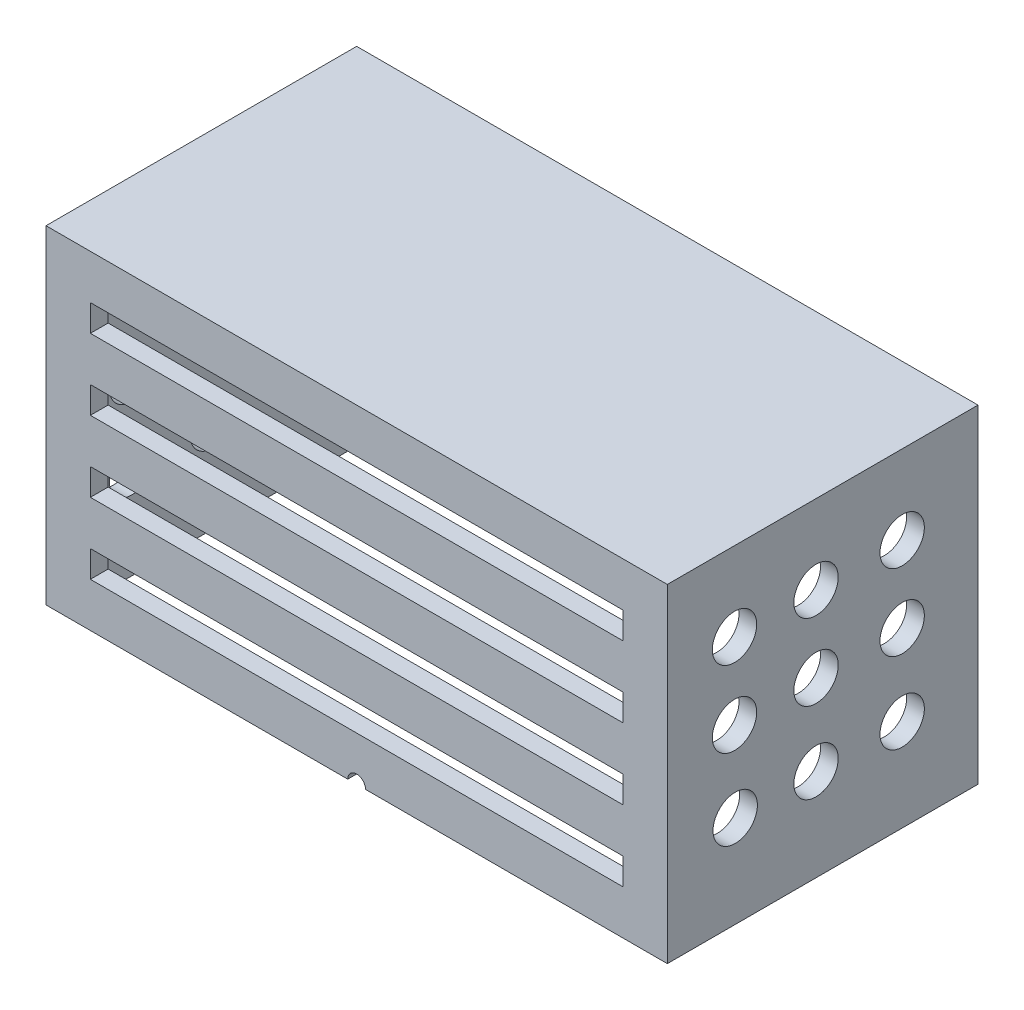
from build123d import *

# Parameters (mm, degrees)
SKETCH1_W           = 70
SKETCH1_H           = 35
BOSS_EXTRUDE1_DEPTH = 37
SHELL1_T            = -2
CUT_EXTRUDE1_DEPTH  = 2
SKETCH3_W           = 60
SKETCH3_H           = 30
CUT_EXTRUDE3_DEPTH  = 2
SKETCH4_W           = 60
SKETCH4_H           = 3
CUT_EXTRUDE4_DEPTH  = 2
SKETCH5_R           = 2.5
CUT_EXTRUDE5_DEPTH  = 2
CUT_EXTRUDE6_START  = -2
SKETCH6_R           = 2.5
CUT_EXTRUDE6_DEPTH  = 2


with BuildPart() as part:
    # Sketch1 → Boss-Extrude1 (new body)
    with BuildSketch(Plane(origin=(0, 0, 0), x_dir=(1, 0, 0), z_dir=(0, 1, 0))):
        with Locations((-44.968255968, 17.192111045)):
            Rectangle(SKETCH1_W, SKETCH1_H)
    extrude(amount=BOSS_EXTRUDE1_DEPTH)

    # Shell1
    shell1_openings = [part.faces().sort_by_distance(p)[0] for p in [
        (-44.968255968, 0, -17.192111045),
    ]]
    offset(amount=SHELL1_T, openings=shell1_openings, kind=Kind.INTERSECTION)

    # Sketch2 → Cut-Extrude1 (cut)
    with BuildSketch(Plane.XY.offset(0.307888955)):
        with BuildLine():
            Line((-45.968255968, 0), (-44.968255968, 0))
            Line((-44.968255968, 0), (-43.968255968, 0))
            ThreePointArc((-43.968255968, 0), (-44.968255968, 1), (-45.968255968, 0))
        make_face()
    extrude(amount=-CUT_EXTRUDE1_DEPTH, mode=Mode.SUBTRACT)

    # Sketch3 → Cut-Extrude3 (cut)
    with BuildSketch(Plane(origin=(0, 0, -34.692111045), x_dir=(-1, 0, 0), z_dir=(0, 0, -1))):
        with Locations((44.968255968, 15)):
            Rectangle(SKETCH3_W, SKETCH3_H)
    extrude(amount=-CUT_EXTRUDE3_DEPTH, mode=Mode.SUBTRACT)

    # Sketch4 → Cut-Extrude4 (cut)
    with BuildSketch(Plane.XY.offset(0.307888955)):
        with Locations((-44.968255968, 14.5)):
            Rectangle(SKETCH4_W, SKETCH4_H)
        with Locations((-44.968255968, 22.5)):
            Rectangle(SKETCH4_W, SKETCH4_H)
        with Locations((-44.968255968, 30.5)):
            Rectangle(SKETCH4_W, SKETCH4_H)
        with Locations((-44.968255968, 6.5)):
            Rectangle(SKETCH4_W, SKETCH4_H)
    extrude(amount=-CUT_EXTRUDE4_DEPTH, mode=Mode.SUBTRACT)

    # Sketch5 → Cut-Extrude5 (cut)
    with BuildSketch(Plane.ZY.offset(79.968255968)):
        with Locations((-26.149373003, 28.09173468)):
            Circle(SKETCH5_R)
        with Locations((-26.149373003, 19.50769197)):
            Circle(SKETCH5_R)
        with Locations((-26.149373003, 10.401142313)):
            Circle(SKETCH5_R)
        with Locations((-16.445672549, 10.401142313)):
            Circle(SKETCH5_R)
        with Locations((-16.445672549, 19.50769197)):
            Circle(SKETCH5_R)
        with Locations((-16.445672549, 28.09173468)):
            Circle(SKETCH5_R)
        with Locations((-7.339122891, 28.09173468)):
            Circle(SKETCH5_R)
        with Locations((-7.339122891, 19.50769197)):
            Circle(SKETCH5_R)
        with Locations((-7.339122891, 10.401142313)):
            Circle(SKETCH5_R)
    extrude(amount=-CUT_EXTRUDE5_DEPTH, mode=Mode.SUBTRACT)

    # Sketch6 → Cut-Extrude6 (cut)
    with BuildSketch(Plane(origin=(-9.968255968, 0, 0), x_dir=(0, 0, -1), z_dir=(1, 0, 0)).offset(CUT_EXTRUDE6_START)):
        with Locations((7.264479042, 28.09173468)):
            Circle(SKETCH6_R)
        with Locations((7.264479042, 19.50769197)):
            Circle(SKETCH6_R)
        with Locations(Location((7.339122891, 10.401142313, 0), (0, 0, 180))):
            Circle(SKETCH6_R)
        with Locations(Location((16.445672549, 10.401142313, 0), (0, 0, 180))):
            Circle(SKETCH6_R)
        with Locations(Location((16.445672549, 19.50769197, 0), (0, 0, 180))):
            Circle(SKETCH6_R)
        with Locations(Location((26.149373003, 19.50769197, 0), (0, 0, 180))):
            Circle(SKETCH6_R)
        with Locations(Location((16.445672549, 28.09173468, 0), (0, 0, 180))):
            Circle(SKETCH6_R)
        with Locations(Location((26.149373003, 28.09173468, 0), (0, 0, 180))):
            Circle(SKETCH6_R)
        with Locations(Location((26.149373003, 10.401142313, 0), (0, 0, 180))):
            Circle(SKETCH6_R)
    extrude(amount=CUT_EXTRUDE6_DEPTH, mode=Mode.SUBTRACT)


solid = part.part
